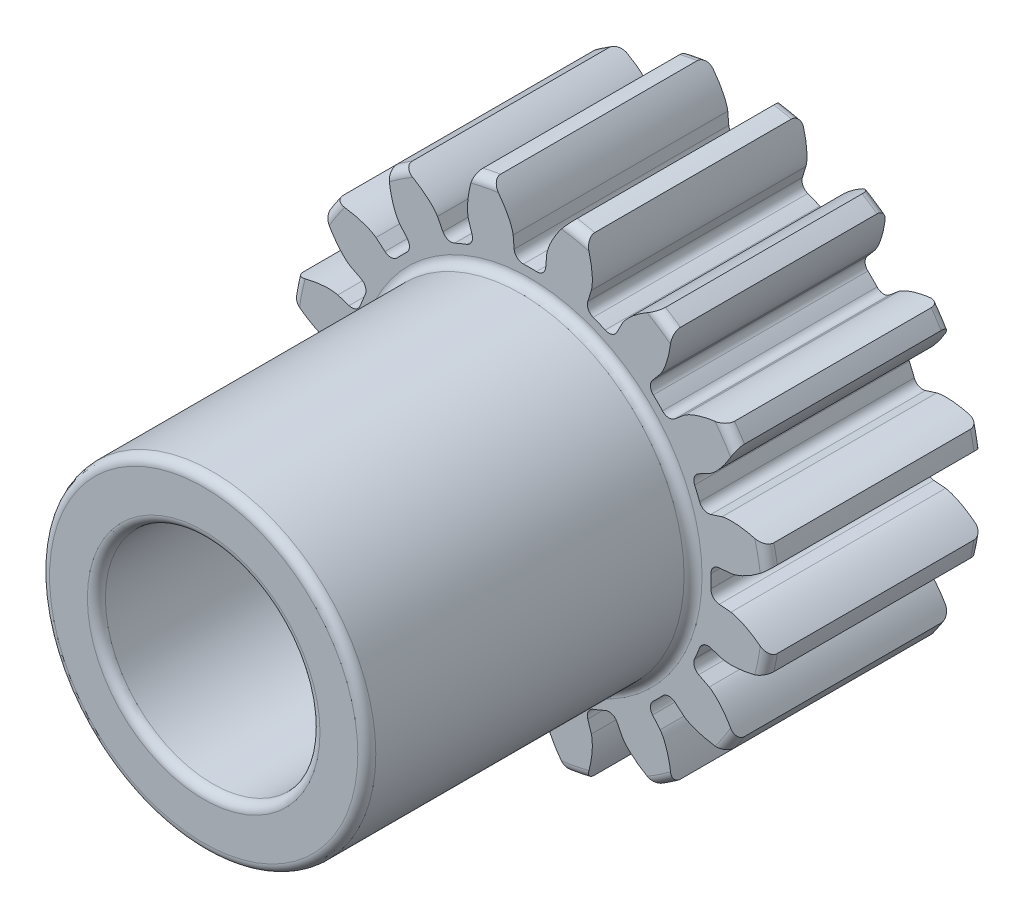
from build123d import *

# Parameters (mm, degrees)
BOSS_EXTRUDE1_DEPTH      = 4.0005
BOSS_EXTRUDE1_DEPTH_BACK = 4.0005
SKETCH3_R                = 3.571875
SKETCH5_W                = 4.826
SKETCH5_H                = 1.158875
SKETCH5_W_2              = 8.001
SKETCH5_H_2              = 1.5875
FILLET2_R                = 0.133153561
CUT_EXTRUDE1_DEPTH       = 7.443646833
FILLET1_R                = 0.133153561
CIRPATTERN1_COUNT        = 16
FILLET1_OF_CIRPATTERN1_R = 0.133153561


with BuildPart() as part:
    # Sketch3 → Boss-Extrude1 (new, two sides: drawn at the far end of the back side and taken through both)
    with BuildSketch(Plane.XY.offset(-BOSS_EXTRUDE1_DEPTH_BACK)):
        Circle(SKETCH3_R)
    extrude(amount=BOSS_EXTRUDE1_DEPTH + BOSS_EXTRUDE1_DEPTH_BACK)

    # Sketch5 → Cut-Revolve1 (revolve, cut)
    with BuildSketch(Plane(origin=(0, 0, 0), x_dir=(0, 0, -1), z_dir=(1, 0, 0)), mode=Mode.PRIVATE) as cut_revolve1_sk:
        with Locations((-1.5875, 2.9924375)):
            Rectangle(SKETCH5_W, SKETCH5_H)
        with Locations((0, 0.79375)):
            Rectangle(SKETCH5_W_2, SKETCH5_H_2)
    revolve(cut_revolve1_sk.sketch.rotate(Axis((0, 0, 4.0005), (0, 0, -1)), 90), axis=Axis((0, 0, 4.0005), (0, 0, -1)), mode=Mode.SUBTRACT)

    # Fillet2
    fillet2_edges = [part.edges().sort_by_distance(p)[0] for p in [
        (-1.5875, 0, 4.0005),
        (-1.5875, 0, -4.0005),
        (-2.413, 0, 4.0005),
        (-2.413, 0, -0.8255),
        (-3.571875, 0, -0.8255),
        (-3.571875, 0, -4.0005),
    ]]
    fillet(fillet2_edges, radius=FILLET2_R)

    # Sketch4 → Cut-Extrude1 (cut, symmetric)
    with BuildSketch(Plane.XY):
        with BuildLine():
            Line((2.669623905, 0.222815851), (2.973186232, 0.248152191))
            add(Edge.make_bspline(
                [(2.973186232, 0.248152191), (2.974137529, 0.248244946), (2.976801658, 0.248546125), (2.981821603, 0.249277452), (2.98998406, 0.250700198), (3.000338012, 0.252849589), (3.013660027, 0.256013022), (3.029268539, 0.260233776), (3.046323851, 0.26538815), (3.064764289, 0.271550376), (3.083052436, 0.278186632), (3.101187705, 0.285259395), (3.119151447, 0.292712163), (3.140783757, 0.302218639), (3.166541028, 0.314282052), (3.196363405, 0.329343052), (3.229837022, 0.347553194), (3.263552967, 0.367307966), (3.296392835, 0.387725715), (3.329161638, 0.409468447), (3.360573865, 0.43129396), (3.392750953, 0.455088529), (3.422224837, 0.477625581), (3.454720681, 0.50410362), (3.480793874, 0.52583185), (3.507271537, 0.549289968), (3.520090285, 0.560856054), (3.52661244, 0.566829527)],
                knots=[0, 0, 0, 0, 0, 0.005376749, 0.015083688, 0.02853182, 0.04661014, 0.064854849, 0.092110526, 0.119476176, 0.146842496, 0.174208854, 0.201574956, 0.228941013, 0.256307345, 0.307035032, 0.361767352, 0.416499661, 0.471231937, 0.525964282, 0.580696616, 0.635428982, 0.690161387, 0.744893688, 0.799626082, 0.854358408, 0.909090915, 0.909090915, 0.909090915, 0.909090915, 0.909090915], degree=4))
            ThreePointArc((3.52661244, 0.566829527), (3.571875, 0), (3.52661244, -0.566829527))
            add(Edge.make_bspline(
                [(2.973186232, -0.248152191), (2.974137529, -0.248244946), (2.976801658, -0.248546125), (2.981821603, -0.249277452), (2.98998406, -0.250700198), (3.000338012, -0.252849589), (3.013660027, -0.256013022), (3.029268539, -0.260233776), (3.046323851, -0.26538815), (3.064764289, -0.271550376), (3.083052436, -0.278186632), (3.101187705, -0.285259395), (3.119151447, -0.292712163), (3.140783757, -0.302218639), (3.166541028, -0.314282052), (3.196363405, -0.329343052), (3.229837022, -0.347553194), (3.263552967, -0.367307966), (3.296392835, -0.387725715), (3.329161638, -0.409468447), (3.360573865, -0.43129396), (3.392750953, -0.455088529), (3.422224837, -0.477625581), (3.454720681, -0.50410362), (3.480793874, -0.52583185), (3.507271537, -0.549289968), (3.520090285, -0.560856054), (3.52661244, -0.566829527)],
                knots=[0, 0, 0, 0, 0, 0.005376749, 0.015083688, 0.02853182, 0.04661014, 0.064854849, 0.092110526, 0.119476176, 0.146842496, 0.174208854, 0.201574956, 0.228941013, 0.256307345, 0.307035032, 0.361767352, 0.416499661, 0.471231937, 0.525964282, 0.580696616, 0.635428982, 0.690161387, 0.744893688, 0.799626082, 0.854358408, 0.909090915, 0.909090915, 0.909090915, 0.909090915, 0.909090915], degree=4))
            Line((2.973186232, -0.248152191), (2.669623905, -0.222815851))
            ThreePointArc((2.669623905, -0.222815851), (2.67890625, 0), (2.669623905, 0.222815851))
        make_face()
    cut_extrude1 = extrude(amount=CUT_EXTRUDE1_DEPTH, both=True, mode=Mode.SUBTRACT)

    # Fillet1
    fillet1_edges = [part.edges().sort_by_distance(p)[0] for p in [
        (2.669623905, -0.222815851, -2.413),
        (2.669623905, 0.222815851, -2.413),
    ]]
    fillet(fillet1_edges, radius=FILLET1_R)

    # CirPattern1: Cut-Extrude1 ×16 about axis
    cirpattern1_axis = Axis((0, 0, 4.0005), (0, 0, -1))
    for i in range(1, CIRPATTERN1_COUNT):
        add(cut_extrude1.rotate(cirpattern1_axis, i * 360 / CIRPATTERN1_COUNT), mode=Mode.SUBTRACT)

    # Fillet1 of CirPattern1
    fillet1_of_cirpattern1_edges = [part.edges().sort_by_distance(p)[0] for p in [
        (2.38114295, -1.227475843, -2.413),
        (2.55167882, -0.815765834, -2.413),
        (1.730154567, -2.045263766, -2.413),
        (2.045263766, -1.730154567, -2.413),
        (0.815765834, -2.55167882, -2.413),
        (1.227475843, -2.38114295, -2.413),
        (-0.222815851, -2.669623905, -2.413),
        (0.222815851, -2.669623905, -2.413),
        (-1.227475843, -2.38114295, -2.413),
        (-0.815765834, -2.55167882, -2.413),
        (-2.045263766, -1.730154567, -2.413),
        (-1.730154567, -2.045263766, -2.413),
        (-2.55167882, -0.815765834, -2.413),
        (-2.38114295, -1.227475843, -2.413),
        (-2.669623905, 0.222815851, -2.413),
        (-2.669623905, -0.222815851, -2.413),
        (-2.38114295, 1.227475843, -2.413),
        (-2.55167882, 0.815765834, -2.413),
        (-1.730154567, 2.045263766, -2.413),
        (-2.045263766, 1.730154567, -2.413),
        (-0.815765834, 2.55167882, -2.413),
        (-1.227475843, 2.38114295, -2.413),
        (0.222815851, 2.669623905, -2.413),
        (-0.222815851, 2.669623905, -2.413),
        (1.227475843, 2.38114295, -2.413),
        (0.815765834, 2.55167882, -2.413),
        (2.045263766, 1.730154567, -2.413),
        (1.730154567, 2.045263766, -2.413),
        (2.55167882, 0.815765834, -2.413),
        (2.38114295, 1.227475843, -2.413),
    ]]
    fillet(fillet1_of_cirpattern1_edges, radius=FILLET1_OF_CIRPATTERN1_R)


solid = part.part
